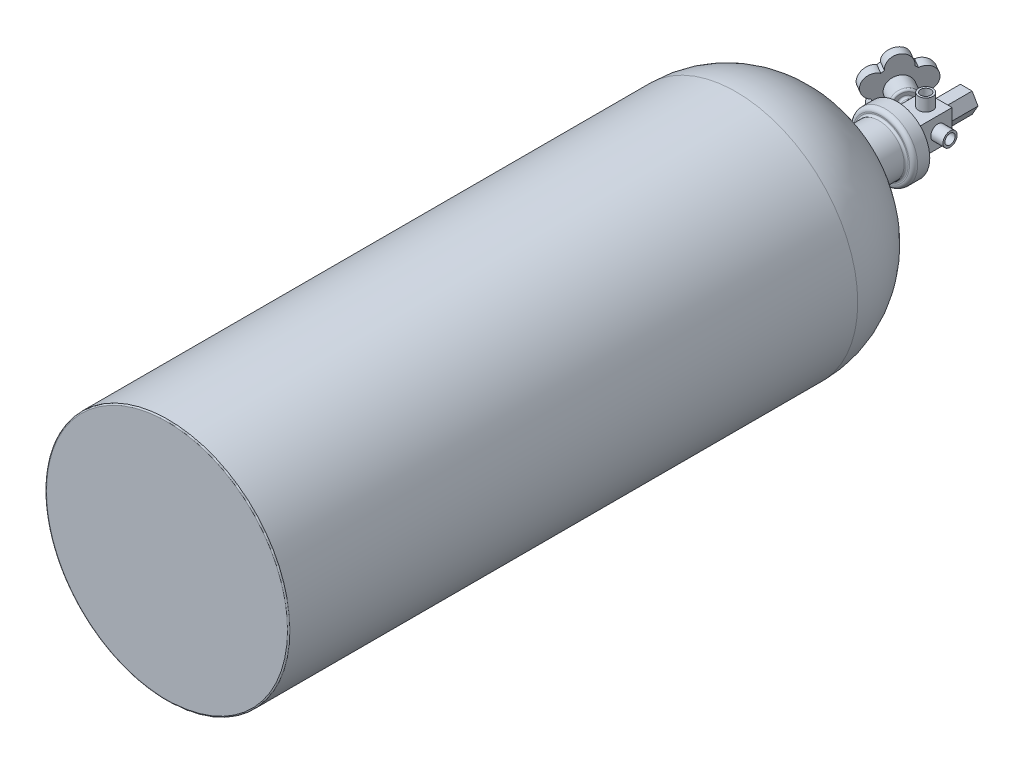
from build123d import *

# Parameters (mm, degrees)
SKETCH4_W           = 17.78
SKETCH4_H           = 17.78
BOSS_EXTRUDE1_DEPTH = 25.4
SKETCH5_R           = 3.175
SKETCH5_R_2         = 2.54
BOSS_EXTRUDE2_DEPTH = 5.08
SKETCH6_R           = 4.445
SKETCH6_R_2         = 3.175
BOSS_EXTRUDE3_DEPTH = 7.62
SKETCH7_R           = 4.445
SKETCH7_R_2         = 3.175
BOSS_EXTRUDE4_DEPTH = 7.62
SKETCH14_R          = 13.335
BOSS_EXTRUDE5_DEPTH = 7.62
BOSS_EXTRUDE6_DEPTH = 7.62
CIRPATTERN1_COUNT   = 5
BOSS_EXTRUDE7_DEPTH = 17.78


with BuildPart() as part:
    # Sketch3 → Revolve1 (revolve)
    with BuildSketch(Plane(origin=(0, 0, 0), x_dir=(1, 0, 0), z_dir=(0, 1, 0)), mode=Mode.PRIVATE) as revolve1_sk:
        with BuildLine():
            Line((0, 0), (-75.438, 0))
            ThreePointArc((-75.438, 0), (-75.976815367, 0.223184633), (-76.2, 0.762))
            Line((-76.2, 0.762), (-76.2, 356.235116514))
            ThreePointArc((-76.2, 356.235116514), (-60.526618682, 398.006692322), (-21.243636364, 419.157737865))
            ThreePointArc((-21.243636364, 419.157737865), (-17.315338132, 421.272842419), (-15.748, 425.45))
            Line((-15.748, 425.45), (-15.748, 445.77))
            ThreePointArc((-15.748, 445.77), (-16.119974388, 446.668025612), (-17.018, 447.04))
            Line((-17.018, 447.04), (-17.78, 447.04))
            ThreePointArc((-17.78, 447.04), (-19.576051224, 447.783948776), (-20.32, 449.58))
            Line((-20.32, 449.58), (-20.32, 457.2))
            Line((-20.32, 457.2), (0, 457.2))
            Line((0, 457.2), (0, 0))
        make_face()
    revolve(revolve1_sk.sketch.rotate(Axis((0, 0, 0), (0, 0, -1)), 180), axis=Axis((0, 0, 0), (0, 0, -1)))

    # Sketch4 → Boss-Extrude1 (add)
    with BuildSketch(Plane(origin=(0, 0, -457.2), x_dir=(-1, 0, 0), z_dir=(0, 0, -1))):
        Rectangle(SKETCH4_W, SKETCH4_H)
    extrude(amount=BOSS_EXTRUDE1_DEPTH)

    # Sketch5 → Boss-Extrude2 (add)
    with BuildSketch(Plane.XZ.offset(8.89)):
        with Locations(Location((0, -462.28, 0), (0, 0, 180))):
            Circle(SKETCH5_R)
        with Locations((0, -462.28)):
            Circle(SKETCH5_R_2, mode=Mode.SUBTRACT)
    extrude(amount=BOSS_EXTRUDE2_DEPTH)

    # Sketch6 → Boss-Extrude3 (add)
    with BuildSketch(Plane(origin=(8.89, 0, 0), x_dir=(0, 0, -1), z_dir=(1, 0, 0))):
        with Locations(Location((473.71, 0, 0), (0, 0, 270))):
            Circle(SKETCH6_R)
        with Locations(Location((473.71, 0, 0), (0, 0, 270))):
            Circle(SKETCH6_R_2, mode=Mode.SUBTRACT)
    extrude(amount=BOSS_EXTRUDE3_DEPTH)

    # Sketch7 → Boss-Extrude4 (add)
    with BuildSketch(Plane(origin=(0, 8.89, 0), x_dir=(1, 0, 0), z_dir=(0, 1, 0))):
        with Locations((0, 474.98)):
            Circle(SKETCH7_R)
        with Locations((0, 474.98)):
            Circle(SKETCH7_R_2, mode=Mode.SUBTRACT)
    extrude(amount=BOSS_EXTRUDE4_DEPTH)

    # Sketch10 → Revolve2 (revolve)
    with BuildSketch(Plane(origin=(203.449873145, 0, -352.38551708), x_dir=(0, 1, 0), z_dir=(-0.499999999999998, 0, 0.8660254037844398)), mode=Mode.PRIVATE) as revolve2_sk:
        with BuildLine():
            Line((3.175, 233.60103416), (3.175, 252.65103416))
            ThreePointArc((3.175, 252.65103416), (3.546974388, 253.549059772), (4.445, 253.92103416))
            Line((4.445, 253.92103416), (6.35, 253.92103416))
            ThreePointArc((6.35, 253.92103416), (7.248025612, 254.293008548), (7.62, 255.19103416))
            Line((7.62, 255.19103416), (7.62, 265.35103416))
            Line((7.62, 265.35103416), (0, 265.35103416))
            Line((0, 265.35103416), (0, 233.60103416))
            Line((0, 233.60103416), (3.175, 233.60103416))
        make_face()
    revolve(revolve2_sk.sketch.rotate(Axis((203.449873145, 0, -352.38551708), (-0.8660254037844399, 0, -0.4999999999999979)), 90), axis=Axis((203.449873145, 0, -352.38551708), (-0.8660254037844399, 0, -0.4999999999999979)))

    # Sketch14 → Boss-Extrude5 (add)
    with BuildSketch(Plane(origin=(-229.800736503, 0, -132.67551708), x_dir=(-0.4999999999999982, 0, 0.8660254037844397), z_dir=(-0.8660254037844398, 0, -0.4999999999999983))):
        with Locations((-406.89974629, 0)):
            Circle(SKETCH14_R)
    extrude(amount=BOSS_EXTRUDE5_DEPTH)

    # Sketch11 → Boss-Extrude6 (add)
    with BuildSketch(Plane(origin=(-229.800736503, 0, -132.67551708), x_dir=(-0.49999999999999833, 0, 0.8660254037844396), z_dir=(-0.8660254037844396, 0, -0.49999999999999833))):
        with BuildLine():
            ThreePointArc((-413.88474629, 11.359225326), (-406.89974629, 19.05), (-399.91474629, 11.359225326))
            ThreePointArc((-399.91474629, 11.359225326), (-406.89974629, 13.335), (-413.88474629, 11.359225326))
        make_face()
    boss_extrude6 = extrude(amount=BOSS_EXTRUDE6_DEPTH)

    # CirPattern1: Boss-Extrude6 ×5 about axis
    cirpattern1_axis = Axis((203.449873145, 0, -352.38551708), (0.8660254037844396, 0, 0.4999999999999983))
    for i in range(1, CIRPATTERN1_COUNT):
        add(boss_extrude6.rotate(cirpattern1_axis, i * 360 / CIRPATTERN1_COUNT))

    # Sketch15 → Cut-Revolve2 (revolve, cut)
    with BuildSketch(Plane(origin=(203.449873145, 0, -352.38551708), x_dir=(0, 1, 0), z_dir=(-0.499999999999998, 0, 0.8660254037844398)), mode=Mode.PRIVATE) as cut_revolve2_sk:
        with BuildLine():
            Line((20.32, 270.43103416), (20.32, 290.75103416))
            Line((20.32, 290.75103416), (0, 290.75103416))
            Line((0, 290.75103416), (0, 272.97103416))
            Line((0, 272.97103416), (8.89, 272.97103416))
            Line((8.89, 272.97103416), (8.89, 272.46303416))
            ThreePointArc((8.89, 272.46303416), (14.722648821, 272.108808778), (20.32, 270.43103416))
        make_face()
    revolve(cut_revolve2_sk.sketch.rotate(Axis((203.449873145, 0, -352.38551708), (-0.8660254037844397, 0, -0.49999999999999806)), 90), axis=Axis((203.449873145, 0, -352.38551708), (-0.8660254037844397, 0, -0.49999999999999806)), mode=Mode.SUBTRACT)

    # Sketch16 → Boss-Extrude7 (add)
    with BuildSketch(Plane(origin=(0, 0, -482.6), x_dir=(-1, 0, 0), z_dir=(0, 0, -1))):
        Polygon((-3.666174209, 6.35), (3.666174209, 6.35), (7.332348419, 0), (3.666174209, -6.35), (-3.666174209, -6.35), (-7.332348419, 0), align=None)
    extrude(amount=BOSS_EXTRUDE7_DEPTH)


solid = part.part
